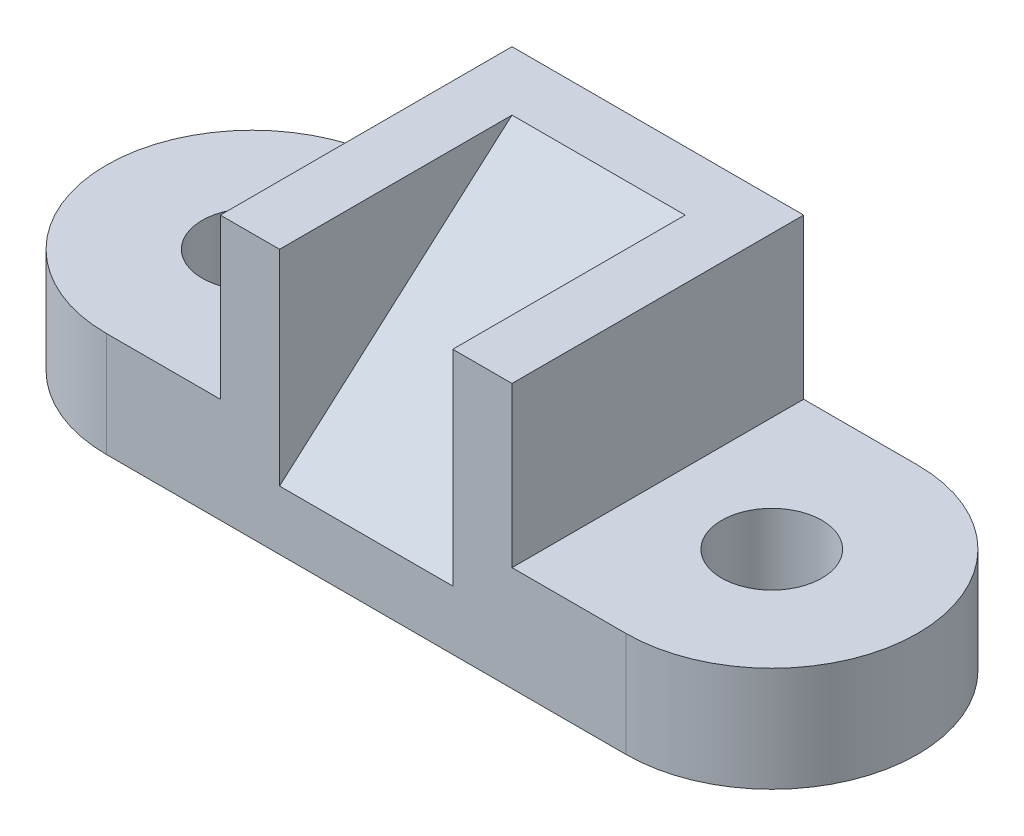
from build123d import *

# Parameters (mm, degrees)
SKETCH1_R           = 11
BOSS_EXTRUDE2_DEPTH = 13
SKETCH4_W           = 38
SKETCH4_H           = 51
BOSS_EXTRUDE3_DEPTH = 45
CUT_EXTRUDE1_DEPTH  = 45
BOSS_EXTRUDE4_DEPTH = 45
SKETCH15_R          = 11
BOSS_EXTRUDE6_DEPTH = 10
SKETCH16_R          = 11
BOSS_EXTRUDE7_DEPTH = 10


with BuildPart() as part:
    # Sketch1 → Boss-Extrude2 (new body)
    with BuildSketch(Plane(origin=(0, 0, 0), x_dir=(1, 0, 0), z_dir=(0, 1, 0))):
        with BuildLine():
            Line((-57, 32), (57, 32))
            ThreePointArc((57, 32), (89, 0), (57, -32))
            Line((57, -32), (-57, -32))
            ThreePointArc((-57, -32), (-89, 0), (-57, 32))
        make_face()
        with Locations(Location((-57, 0, 0), (0, 0, 90))):
            Circle(SKETCH1_R, mode=Mode.SUBTRACT)
        with Locations(Location((57, 0, 0), (0, 0, 90))):
            Circle(SKETCH1_R, mode=Mode.SUBTRACT)
    extrude(amount=BOSS_EXTRUDE2_DEPTH)

    # Sketch4 → Boss-Extrude3 (add)
    with BuildSketch(Plane(origin=(0, 13, 0), x_dir=(1, 0, 0), z_dir=(0, 1, 0))):
        with Locations((0, -6.5)):
            Rectangle(SKETCH4_W, SKETCH4_H)
    extrude(amount=BOSS_EXTRUDE3_DEPTH)

    # Sketch5 → Cut-Extrude1 (cut)
    with BuildSketch(Plane(origin=(19, 0, 0), x_dir=(0, 0, -1), z_dir=(1, 0, 0))):
        Polygon((19, 58), (-32, 13), (-32, 58), align=None)
    extrude(amount=-CUT_EXTRUDE1_DEPTH, mode=Mode.SUBTRACT)

    # Sketch6 → Boss-Extrude4 (add)
    with BuildSketch(Plane(origin=(0, 13, 0), x_dir=(1, 0, 0), z_dir=(0, 1, 0))):
        Polygon((-32, 32), (-32, -32), (-19, -32), (-19, 19), (19, 19), (19, -32), (32, -32), (32, 32), align=None)
    extrude(amount=BOSS_EXTRUDE4_DEPTH)

    # Sketch15 → Boss-Extrude6 (add)
    with BuildSketch(Plane(origin=(0, 13, 0), x_dir=(1, 0, 0), z_dir=(0, 1, 0))):
        with BuildLine():
            Line((-32, 32), (-57, 32))
            ThreePointArc((-57, 32), (-89, 0), (-57, -32))
            Line((-57, -32), (-32, -32))
            Line((-32, -32), (-32, 32))
        make_face()
        with Locations(Location((-57, 0, 0), (0, 0, 90))):
            Circle(SKETCH15_R, mode=Mode.SUBTRACT)
    extrude(amount=BOSS_EXTRUDE6_DEPTH)

    # Sketch16 → Boss-Extrude7 (add)
    with BuildSketch(Plane(origin=(0, 13, 0), x_dir=(1, 0, 0), z_dir=(0, 1, 0))):
        with BuildLine():
            Line((32, -32), (57, -32))
            ThreePointArc((57, -32), (89, 0), (57, 32))
            Line((57, 32), (32, 32))
            Line((32, 32), (32, -32))
        make_face()
        with Locations(Location((57, 0, 0), (0, 0, 90))):
            Circle(SKETCH16_R, mode=Mode.SUBTRACT)
    extrude(amount=BOSS_EXTRUDE7_DEPTH)


solid = part.part
